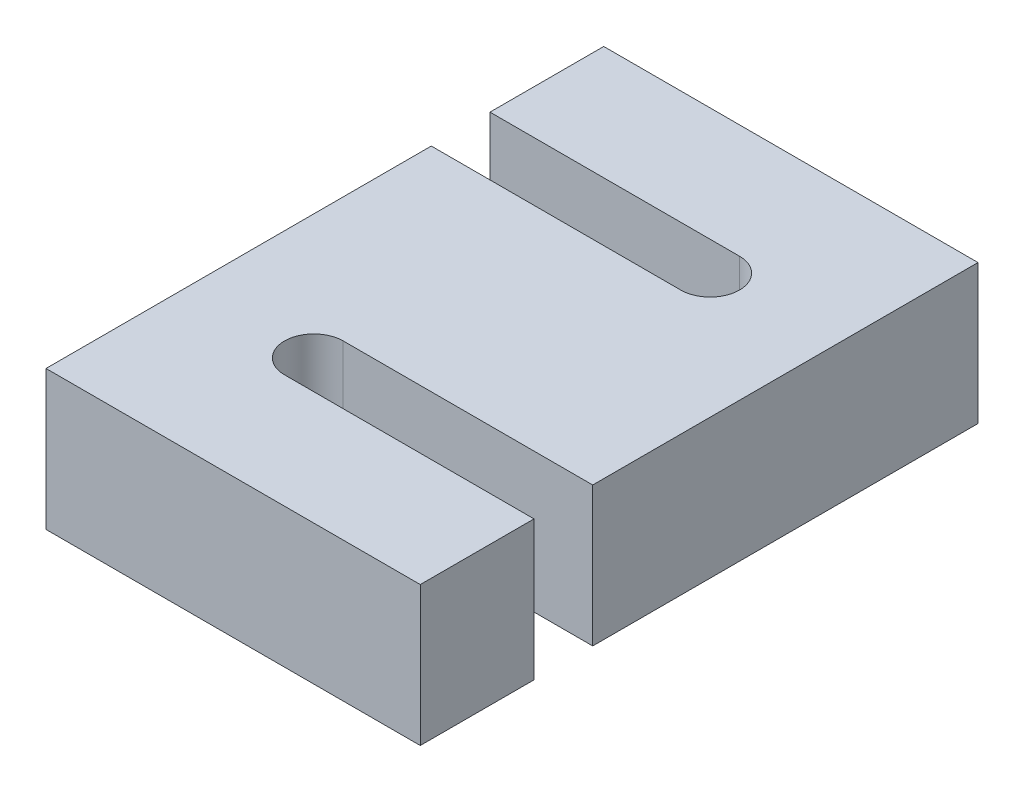
from build123d import *

# Parameters (mm, degrees)
BOSS_EXTRUDE1_DEPTH = 19


with BuildPart() as part:
    # Sketch2 → Boss-Extrude1 (new body)
    with BuildSketch(Plane(origin=(0, 0, 0), x_dir=(1, 0, 0), z_dir=(0, 1, 0))):
        with BuildLine():
            Line((25.5, 0), (-8.5, 0))
            ThreePointArc((-8.5, 0), (-12.5, -4), (-8.5, -8))
            Line((-8.5, -8), (25.5, -8))
            Line((25.5, -8), (25.5, -23.5))
            Line((25.5, -23.5), (-25.5, -23.5))
            Line((-25.5, -23.5), (-25.5, 29))
            Line((-25.5, 29), (8.5, 29))
            ThreePointArc((8.5, 29), (12.5, 33), (8.5, 37))
            Line((8.5, 37), (-25.5, 37))
            Line((-25.5, 37), (-25.5, 52.5))
            Line((-25.5, 52.5), (25.5, 52.5))
            Line((25.5, 52.5), (25.5, 0))
        make_face()
    extrude(amount=BOSS_EXTRUDE1_DEPTH)


solid = part.part
